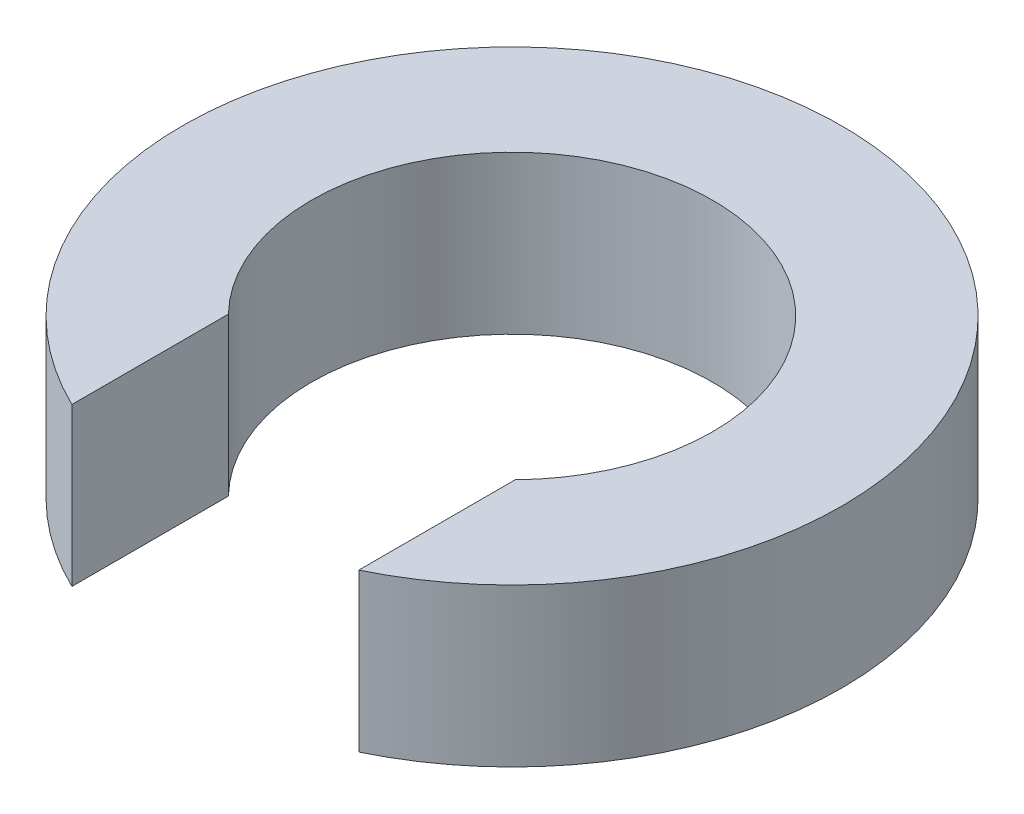
from build123d import *

# Parameters (mm, degrees)
CROQUIS1_R              = 11.5
CROQUIS1_R_2            = 7
SALIENTE_EXTRUIR1_DEPTH = 5.5
CROQUIS2_W              = 10.010478692
CROQUIS2_H              = 6.606373626
CORTAR_EXTRUIR1_DEPTH   = 18.168284713


with BuildPart() as part:
    # Croquis1 → Saliente-Extruir1 (new body)
    with BuildSketch(Plane(origin=(0, 0, 0), x_dir=(1, 0, 0), z_dir=(0, 1, 0))):
        with Locations(Location((0, 0, 0), (0, 0, 270))):
            Circle(CROQUIS1_R)
        with Locations(Location((0, 0, 0), (0, 0, 270))):
            Circle(CROQUIS1_R_2, mode=Mode.SUBTRACT)
    extrude(amount=SALIENTE_EXTRUIR1_DEPTH)

    # Croquis2 → Cortar-Extruir1 (cut, through all)
    with BuildSketch(Plane(origin=(0, 5.5, 0), x_dir=(1, 0, 0), z_dir=(0, 1, 0))):
        with Locations((0, -8.196813187)):
            Rectangle(CROQUIS2_W, CROQUIS2_H)
    extrude(amount=-CORTAR_EXTRUIR1_DEPTH, mode=Mode.SUBTRACT)


solid = part.part
